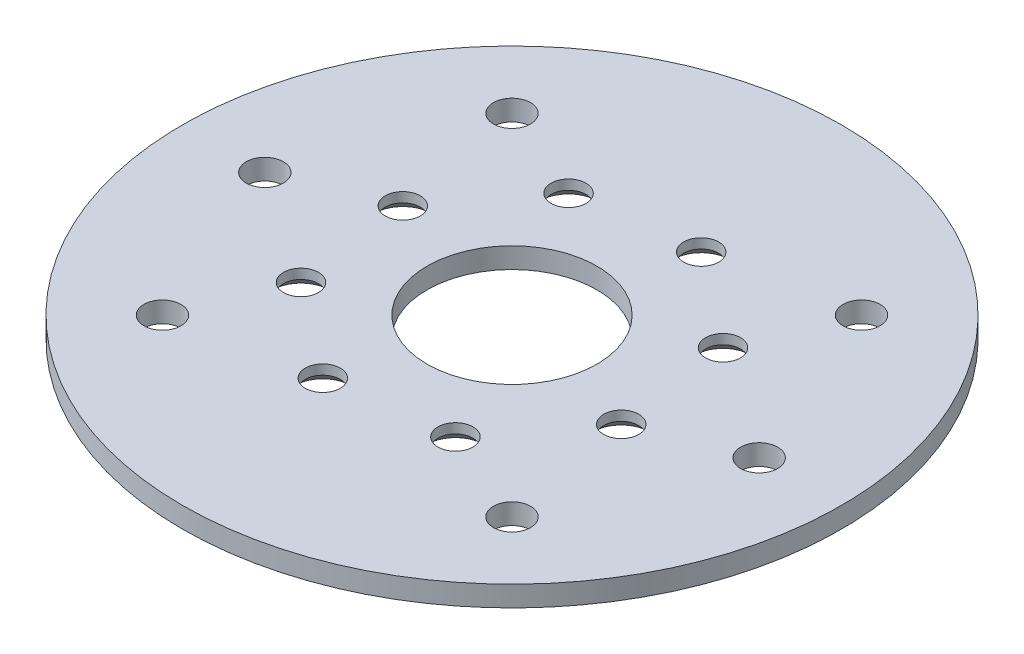
from build123d import *

# Parameters (mm, degrees)
SKETCH1_R                                    = 32
SKETCH1_R_2                                  = 8.25
BOSS_EXTRUDE1_DEPTH                          = 2
CSK_FOR_M3_HEX_SOCKET_COUNTERSUNK_HE_2_COUNT = 2
CSK_FOR_M3_HEX_SOCKET_COUNTERSUNK_HE_2_PITCH = 11.480502971
CSK_FOR_M3_HEX_SOCKET_COUNTERSUNK_HE_3_COUNT = 2
CSK_FOR_M3_HEX_SOCKET_COUNTERSUNK_HE_3_PITCH = 21.213203436
CSK_FOR_M3_HEX_SOCKET_COUNTERSUNK_HE_4_COUNT = 2
CSK_FOR_M3_HEX_SOCKET_COUNTERSUNK_HE_4_PITCH = 27.716385975
CSK_FOR_M3_HEX_SOCKET_COUNTERSUNK_HE_5_COUNT = 2
CSK_FOR_M3_HEX_SOCKET_COUNTERSUNK_HE_5_PITCH = 30
CSK_FOR_M3_HEX_SOCKET_COUNTERSUNK_HE_6_COUNT = 2
CSK_FOR_M3_HEX_SOCKET_COUNTERSUNK_HE_6_PITCH = 27.716385975
CSK_FOR_M3_HEX_SOCKET_COUNTERSUNK_HE_7_COUNT = 2
CSK_FOR_M3_HEX_SOCKET_COUNTERSUNK_HE_7_PITCH = 21.213203436
CSK_FOR_M3_HEX_SOCKET_COUNTERSUNK_HE_8_COUNT = 2
CSK_FOR_M3_HEX_SOCKET_COUNTERSUNK_HE_8_PITCH = 11.480502971
M3_CLEARANCE_HOLE1_D                         = 3.6


with BuildPart() as part:
    # Sketch1 → Boss-Extrude1 (new body)
    with BuildSketch(Plane(origin=(0, 0, 0), x_dir=(1, 0, 0), z_dir=(0, 1, 0))):
        with Locations(Location((0, 0, 0), (0, 0, 270))):
            Circle(SKETCH1_R)
        with Locations(Location((0, 0, 0), (0, 0, 270))):
            Circle(SKETCH1_R_2, mode=Mode.SUBTRACT)
    extrude(amount=BOSS_EXTRUDE1_DEPTH)

    # Sketch4 → CSK for M3 Hex Socket Countersunk Head Screw1 (revolve, cut)
    with BuildSketch(Plane(origin=(3.882285677, 0, -14.488887394), x_dir=(0, 0, -1), z_dir=(1, 0, 0))):
        Polygon((0, 0), (0, 2), (1.7, 2), (1.7, 1.05), (2.75, 0), align=None)
    csk_for_m3_hex_socket_countersunk_head_s = revolve(axis=Axis((3.882285677, -6.35, -14.488887394), (0, 1, 0)), mode=Mode.SUBTRACT)

    # CSK for M3 Hex Socket Countersunk He 2: CSK for M3 Hex Socket Countersunk Head Screw1 ×2
    with Locations(*[Vector(0.7933533402912735, 0, 0.6087614290086708) * (i * CSK_FOR_M3_HEX_SOCKET_COUNTERSUNK_HE_2_PITCH) for i in range(1, CSK_FOR_M3_HEX_SOCKET_COUNTERSUNK_HE_2_COUNT)]):
        add(csk_for_m3_hex_socket_countersunk_head_s, mode=Mode.SUBTRACT)

    # CSK for M3 Hex Socket Countersunk He 3: CSK for M3 Hex Socket Countersunk Head Screw1 ×2
    with Locations(*[Vector(0.5000000000000544, 0, 0.8660254037844073) * (i * CSK_FOR_M3_HEX_SOCKET_COUNTERSUNK_HE_3_PITCH) for i in range(1, CSK_FOR_M3_HEX_SOCKET_COUNTERSUNK_HE_3_COUNT)]):
        add(csk_for_m3_hex_socket_countersunk_head_s, mode=Mode.SUBTRACT)

    # CSK for M3 Hex Socket Countersunk He 4: CSK for M3 Hex Socket Countersunk Head Screw1 ×2
    with Locations(*[Vector(0.13052619222011386, 0, 0.9914448613738023) * (i * CSK_FOR_M3_HEX_SOCKET_COUNTERSUNK_HE_4_PITCH) for i in range(1, CSK_FOR_M3_HEX_SOCKET_COUNTERSUNK_HE_4_COUNT)]):
        add(csk_for_m3_hex_socket_countersunk_head_s, mode=Mode.SUBTRACT)

    # CSK for M3 Hex Socket Countersunk He 5: CSK for M3 Hex Socket Countersunk Head Screw1 ×2
    with Locations(*[Vector(-0.25881904510246007, 0, 0.9659258262890846) * (i * CSK_FOR_M3_HEX_SOCKET_COUNTERSUNK_HE_5_PITCH) for i in range(1, CSK_FOR_M3_HEX_SOCKET_COUNTERSUNK_HE_5_COUNT)]):
        add(csk_for_m3_hex_socket_countersunk_head_s, mode=Mode.SUBTRACT)

    # CSK for M3 Hex Socket Countersunk He 6: CSK for M3 Hex Socket Countersunk Head Screw1 ×2
    with Locations(*[Vector(-0.6087614290086708, 0, 0.7933533402912735) * (i * CSK_FOR_M3_HEX_SOCKET_COUNTERSUNK_HE_6_PITCH) for i in range(1, CSK_FOR_M3_HEX_SOCKET_COUNTERSUNK_HE_6_COUNT)]):
        add(csk_for_m3_hex_socket_countersunk_head_s, mode=Mode.SUBTRACT)

    # CSK for M3 Hex Socket Countersunk He 7: CSK for M3 Hex Socket Countersunk Head Screw1 ×2
    with Locations(*[Vector(-0.8660254037844073, 0, 0.5000000000000544) * (i * CSK_FOR_M3_HEX_SOCKET_COUNTERSUNK_HE_7_PITCH) for i in range(1, CSK_FOR_M3_HEX_SOCKET_COUNTERSUNK_HE_7_COUNT)]):
        add(csk_for_m3_hex_socket_countersunk_head_s, mode=Mode.SUBTRACT)

    # CSK for M3 Hex Socket Countersunk He 8: CSK for M3 Hex Socket Countersunk Head Screw1 ×2
    with Locations(*[Vector(-0.9914448613738023, 0, 0.13052619222011383) * (i * CSK_FOR_M3_HEX_SOCKET_COUNTERSUNK_HE_8_PITCH) for i in range(1, CSK_FOR_M3_HEX_SOCKET_COUNTERSUNK_HE_8_COUNT)]):
        add(csk_for_m3_hex_socket_countersunk_head_s, mode=Mode.SUBTRACT)

    # M3 Clearance Hole1 (through all)
    with Locations(Plane(origin=(0, 0, 0), x_dir=(-1, 0, 0), z_dir=(0, -1, 0))):
        with Locations((-16.970562748, -16.970562748), (-24, 0), (-16.970562748, 16.970562748), (16.970562748, 16.970562748), (24, 0), (16.970562748, -16.970562748)):
            Hole(M3_CLEARANCE_HOLE1_D / 2)


solid = part.part
